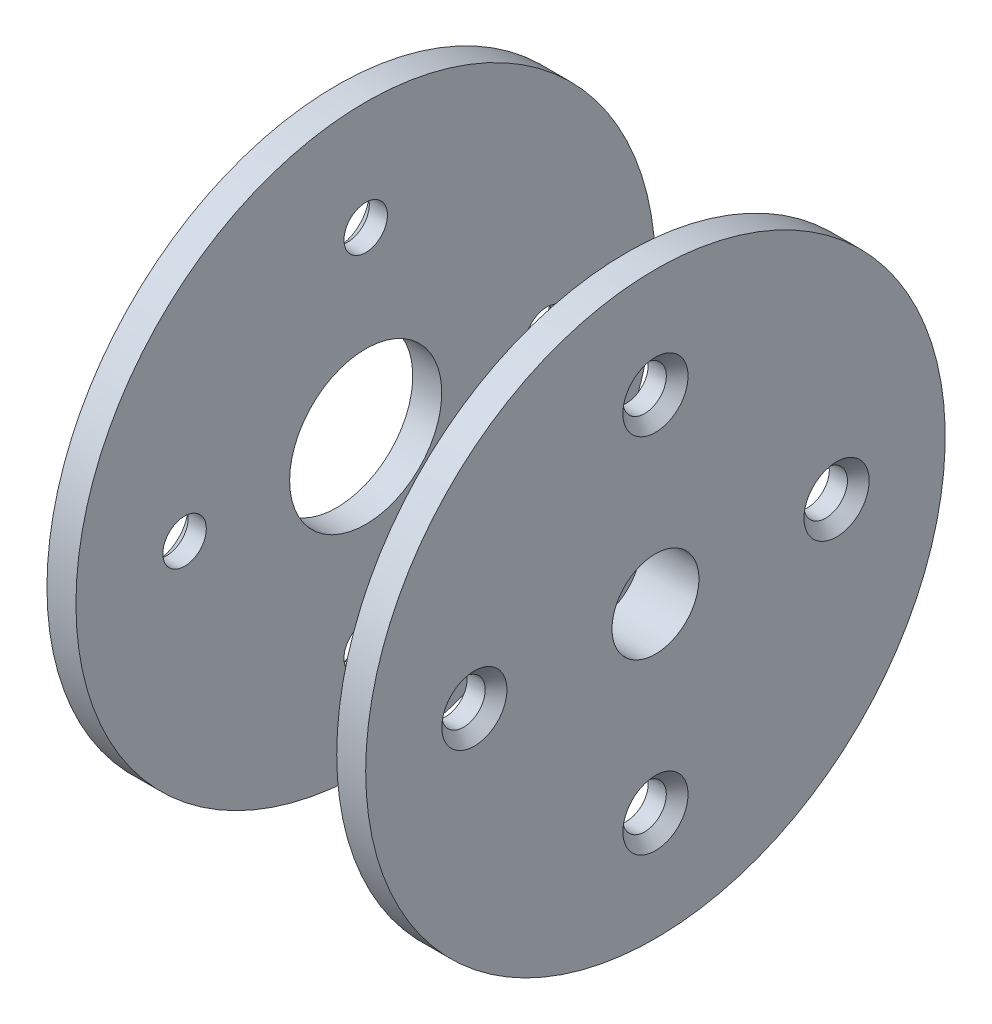
from build123d import *

# Parameters (mm, degrees)
SKETCH1_W          = 4
SKETCH1_H          = 29.5
SKETCH2_R          = 3
CUT_EXTRUDE1_DEPTH = 72.665891469
CHAMFER1_SIZE      = 1.5
CHAMFER2_SIZE      = 1.5


with BuildPart() as part:
    # Sketch1 → Revolve1 (revolve)
    with BuildSketch(Plane.XY, mode=Mode.PRIVATE) as revolve1_sk:
        Polygon((0, 10.5), (11, 10.5), (11, 40), (15, 40), (15, 6), (7, 6), (7, 3.25), (0, 3.25), align=None)
        with Locations((-27, 25.25)):
            Rectangle(SKETCH1_W, SKETCH1_H)
    revolve(revolve1_sk.sketch.rotate(Axis((0, 0, 0), (1, 0, 0)), 90), axis=Axis((0, 0, 0), (1, 0, 0)))

    # Sketch2 → Cut-Extrude1 (cut, through all)
    with BuildSketch(Plane(origin=(15, 0, 0), x_dir=(0, 0, -1), z_dir=(1, 0, 0))):
        with Locations((25, 0)):
            Circle(SKETCH2_R)
        with Locations((0, -25)):
            Circle(SKETCH2_R)
        with Locations((-25, 0)):
            Circle(SKETCH2_R)
        with Locations((0, 25)):
            Circle(SKETCH2_R)
    extrude(amount=-CUT_EXTRUDE1_DEPTH, mode=Mode.SUBTRACT)

    # Chamfer1
    chamfer1_edges = [part.edges().sort_by_distance(p)[0] for p in [
        (15, 0, -22),
        (15, -25, 3),
        (15, 0, 28),
        (15, 25, 3),
    ]]
    chamfer(chamfer1_edges, length=CHAMFER1_SIZE)

    # Chamfer2
    chamfer2_edges = [part.edges().sort_by_distance(p)[0] for p in [
        (-29, 0, -22),
        (-29, -25, 3),
        (-29, 0, 28),
        (-29, 25, 3),
    ]]
    chamfer(chamfer2_edges, length=CHAMFER2_SIZE)


solid = part.part
